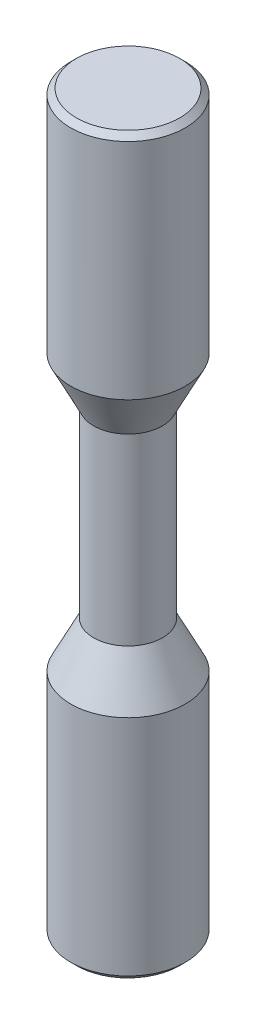
from build123d import *

# Parameters (mm, degrees)
CHAMFER1_SIZE = 0.79375


with BuildPart() as part:
    # Sketch1 → Revolve1 (revolve)
    with BuildSketch(Plane.XY, mode=Mode.PRIVATE) as revolve1_sk:
        Polygon((0, 0), (0, 101.6), (7.9375, 101.6), (7.9375, 69.85), (4.7625, 63.5), (4.7625, 38.1), (7.9375, 31.75), (7.9375, 0), align=None)
    revolve(revolve1_sk.sketch.rotate(Axis((0, 0, 0), (0, 1, 0)), 90), axis=Axis((0, 0, 0), (0, 1, 0)))

    # Chamfer1
    chamfer1_edges = [part.edges().sort_by_distance(p)[0] for p in [
        (0, 0, 7.9375),
        (0, 101.6, 7.9375),
    ]]
    chamfer(chamfer1_edges, length=CHAMFER1_SIZE)


solid = part.part
